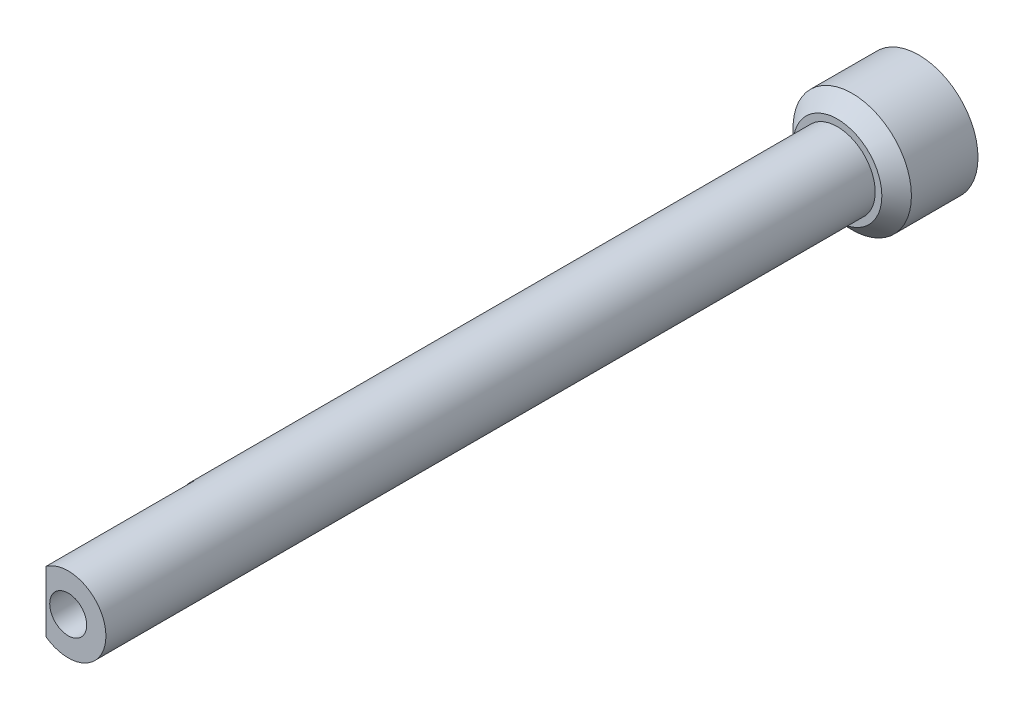
from build123d import *

# Parameters (mm, degrees)
SKETCH_1_R          = 2.55
SKETCH_1_R_2        = 1.25
EXTRUDE_1_DEPTH     = 52
EXTRUDE_START       = 3
SKETCH_2_R          = 4
SKETCH_2_R_2        = 1.25
EXTRUDE_2_DEPTH     = 3
CUT_EXTRUDE_START   = -10
CUT_EXTRUDE_2_DEPTH = 10
EXTRUDE_START_2     = 2.5
SKETCH_9_R          = 4
SKETCH_9_R_2        = 2.6
EXTRUDE_3_DEPTH     = 2.5


with BuildPart() as part:
    # 草图1 → 凸台-拉伸1 (new body)
    with BuildSketch(Plane.XY):
        with Locations(Location((0, 0, 0), (0, 0, 180))):
            Circle(SKETCH_1_R)
        with Locations(Location((0, 0, 0), (0, 0, 180))):
            Circle(SKETCH_1_R_2, mode=Mode.SUBTRACT)
    extrude(amount=EXTRUDE_1_DEPTH)

    # 草图2 → 凸台-拉伸2 (add)
    with BuildSketch(Plane(origin=(0, 0, 0), x_dir=(-1, 0, 0), z_dir=(0, 0, -1)).offset(EXTRUDE_START)):
        Circle(SKETCH_2_R)
        Circle(SKETCH_2_R_2, mode=Mode.SUBTRACT)
    extrude(amount=-EXTRUDE_2_DEPTH)

    # 草图4 → 切除-拉伸2 (cut)
    with BuildSketch(Plane.XY.offset(52).offset(CUT_EXTRUDE_START)):
        with BuildLine():
            Line((-1.5, -2.062159063), (-1.5, 2.062159063))
            ThreePointArc((-1.5, 2.062159063), (-2.55, 0), (-1.5, -2.062159063))
        make_face()
    extrude(amount=CUT_EXTRUDE_2_DEPTH, mode=Mode.SUBTRACT)

    # 草图6 → 切除-旋转1 (revolve, cut)
    with BuildSketch(Plane(origin=(0, 0, 0), x_dir=(1, 0, 0), z_dir=(0, 1, 0)), mode=Mode.PRIVATE) as cut_revolve_1_sk:
        Polygon((0, 1.2), (2.2, 1.2), (2.5, 3), (0, 3), align=None)
    revolve(cut_revolve_1_sk.sketch.rotate(Axis((0, 0, -3), (0, 0, 1)), 180), axis=Axis((0, 0, -3), (0, 0, 1)), mode=Mode.SUBTRACT)

    # 草图8 → 切除-旋转3 (revolve, cut)
    with BuildSketch(Plane(origin=(0, 0, 0), x_dir=(1, 0, 0), z_dir=(0, 1, 0))):
        Polygon((4, 1), (3, 0), (4, 0), align=None)
    revolve(axis=Axis((0, 0, 0), (0, 0, -1)), mode=Mode.SUBTRACT)

    # 草图9 → 凸台-拉伸3 (add)
    with BuildSketch(Plane(origin=(0, 0, -3), x_dir=(-1, 0, 0), z_dir=(0, 0, -1)).offset(EXTRUDE_START_2)):
        with Locations(Location((0, 0, 0), (0, 0, 180))):
            Circle(SKETCH_9_R)
        Circle(SKETCH_9_R_2, mode=Mode.SUBTRACT)
    extrude(amount=-EXTRUDE_3_DEPTH)


solid = part.part
